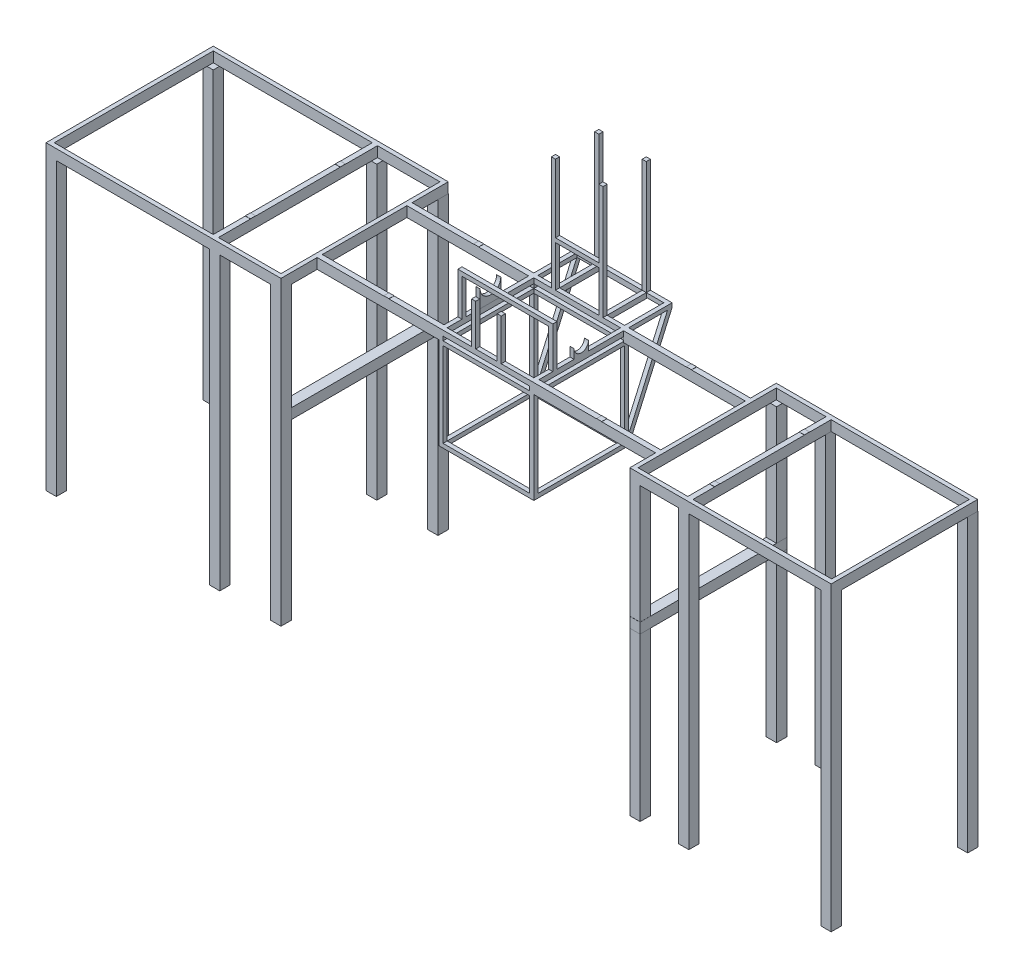
from build123d import *

# Parameters (mm, degrees)
CROQUIS1_W               = 460
CROQUIS1_H               = 460
CROQUIS1_W_2             = 420
CROQUIS1_H_2             = 420
SALIENTE_EXTRUIR1_DEPTH  = 25
CROQUIS2_W               = 20
CROQUIS2_H               = 20
SALIENTE_EXTRUIR2_DEPTH  = 20
CROQUIS3_W               = 460
CROQUIS3_H               = 460
CROQUIS3_W_2             = 420
CROQUIS3_H_2             = 420
SALIENTE_EXTRUIR3_DEPTH  = 20
CROQUIS4_W               = 20
CROQUIS4_H               = 20
SALIENTE_EXTRUIR4_DEPTH  = 410
CROQUIS5_W               = 460
CROQUIS5_H               = 460
CROQUIS5_W_2             = 420
CROQUIS5_H_2             = 420
SALIENTE_EXTRUIR5_DEPTH  = 20
CROQUIS7_W               = 25
CROQUIS7_H               = 50
SALIENTE_EXTRUIR7_DEPTH  = 590
CROQUIS8_W               = 25
CROQUIS8_H               = 50
SALIENTE_EXTRUIR8_DEPTH  = 590
CROQUIS9_W               = 25
CROQUIS9_H               = 25
SALIENTE_EXTRUIR9_DEPTH  = 1
CROQUIS10_W              = 303
CROQUIS10_H              = 770.6
CROQUIS10_W_2            = 241
CROQUIS10_H_2            = 669.6
SALIENTE_EXTRUIR10_DEPTH = 50
CROQUIS11_W              = 50
CROQUIS11_H              = 50
SALIENTE_EXTRUIR11_DEPTH = 1410
CROQUIS13_W              = 20
CROQUIS13_H              = 25
SALIENTE_EXTRUIR12_DEPTH = 210
CROQUIS14_W              = 20
CROQUIS14_H              = 25
SALIENTE_EXTRUIR13_DEPTH = 210
CROQUIS15_W              = 20
CROQUIS15_H              = 20
SALIENTE_EXTRUIR14_DEPTH = 200
CROQUIS16_W              = 20
CROQUIS16_H              = 20
SALIENTE_EXTRUIR15_DEPTH = 550
CROQUIS17_W              = 460
CROQUIS17_H              = 230
CROQUIS17_W_2            = 420
CROQUIS17_H_2            = 190
SALIENTE_EXTRUIR16_DEPTH = 20
SALIENTE_EXTRUIR17_DEPTH = 20
SALIENTE_EXTRUIR18_DEPTH = 20
CROQUIS23_W              = 20
CROQUIS23_H              = 20
SALIENTE_EXTRUIR22_DEPTH = 200
CROQUIS24_W              = 20
CROQUIS24_H              = 20
SALIENTE_EXTRUIR23_DEPTH = 420
SALIENTE_EXTRUIR24_REACH = 2598.882
CROQUIS25_W              = 50
CROQUIS25_H              = 50
SALIENTE_EXTRUIR25_DEPTH = 20
SALIENTE_EXTRUIR26_DEPTH = 20
SALIENTE_EXTRUIR27_REACH = 2475.945
CROQUIS29_W              = 20
CROQUIS29_H              = 20


with BuildPart() as part:
    # Croquis1 → Saliente-Extruir1 (new body)
    with BuildSketch(Plane(origin=(0, 0, 0), x_dir=(1, 0, 0), z_dir=(0, 1, 0))):
        with Locations((230, 230)):
            Rectangle(CROQUIS1_W, CROQUIS1_H)
        with Locations((230, 230)):
            Rectangle(CROQUIS1_W_2, CROQUIS1_H_2, mode=Mode.SUBTRACT)
    extrude(amount=SALIENTE_EXTRUIR1_DEPTH)

    # Croquis2 → Saliente-Extruir2 (add)
    with BuildSketch(Plane.XZ):
        with Locations((10, -10)):
            Rectangle(CROQUIS2_W, CROQUIS2_H)
        with Locations((10, -450)):
            Rectangle(CROQUIS2_W, CROQUIS2_H)
        with Locations((450, -450)):
            Rectangle(CROQUIS2_W, CROQUIS2_H)
        with Locations((450, -10)):
            Rectangle(CROQUIS2_W, CROQUIS2_H)
    extrude(amount=SALIENTE_EXTRUIR2_DEPTH)

    # Croquis3 → Saliente-Extruir3 (add)
    with BuildSketch(Plane.XZ.offset(20)):
        with Locations((230, -230)):
            Rectangle(CROQUIS3_W, CROQUIS3_H)
        with Locations((230, -230)):
            Rectangle(CROQUIS3_W_2, CROQUIS3_H_2, mode=Mode.SUBTRACT)
    extrude(amount=SALIENTE_EXTRUIR3_DEPTH)

    # Croquis4 → Saliente-Extruir4 (add)
    with BuildSketch(Plane.XZ.offset(40)):
        with Locations((10, -10)):
            Rectangle(CROQUIS4_W, CROQUIS4_H)
        with Locations((10, -450)):
            Rectangle(CROQUIS4_W, CROQUIS4_H)
        with Locations((450, -450)):
            Rectangle(CROQUIS4_W, CROQUIS4_H)
        with Locations((450, -10)):
            Rectangle(CROQUIS4_W, CROQUIS4_H)
    extrude(amount=SALIENTE_EXTRUIR4_DEPTH)

    # Croquis5 → Saliente-Extruir5 (add)
    with BuildSketch(Plane.XZ.offset(450)):
        with Locations((230, -230)):
            Rectangle(CROQUIS5_W, CROQUIS5_H)
        with Locations((230, -230)):
            Rectangle(CROQUIS5_W_2, CROQUIS5_H_2, mode=Mode.SUBTRACT)
    extrude(amount=SALIENTE_EXTRUIR5_DEPTH)

    # Croquis7 → Saliente-Extruir7 (add)
    with BuildSketch(Plane.ZY):
        with Locations((-12.5, 0)):
            Rectangle(CROQUIS7_W, CROQUIS7_H)
        with Locations((-447.5, 0)):
            Rectangle(CROQUIS7_W, CROQUIS7_H)
    extrude(amount=SALIENTE_EXTRUIR7_DEPTH)

    # Croquis8 → Saliente-Extruir8 (add)
    with BuildSketch(Plane(origin=(460, 0, 0), x_dir=(0, 0, -1), z_dir=(1, 0, 0))):
        with Locations((12.5, 0)):
            Rectangle(CROQUIS8_W, CROQUIS8_H)
        with Locations((447.5, 0)):
            Rectangle(CROQUIS8_W, CROQUIS8_H)
    extrude(amount=SALIENTE_EXTRUIR8_DEPTH)

    # Croquis9 → Saliente-Extruir9 (add)
    with BuildSketch(Plane(origin=(0, 25, 0), x_dir=(1, 0, 0), z_dir=(0, 1, 0))):
        with Locations((-254.5, 447.5)):
            Rectangle(CROQUIS9_W, CROQUIS9_H)
        with Locations((-254.5, 12.5)):
            Rectangle(CROQUIS9_W, CROQUIS9_H)
        with Locations((776.5, 447.5)):
            Rectangle(CROQUIS9_W, CROQUIS9_H)
        with Locations((776.5, 12.5)):
            Rectangle(CROQUIS9_W, CROQUIS9_H)
        with Locations((-925.5, 12.5)):
            Rectangle(CROQUIS9_W, CROQUIS9_H)
        with Locations((-925.5, 447.5)):
            Rectangle(CROQUIS9_W, CROQUIS9_H)
        with Locations((1323.5, 12.5)):
            Rectangle(CROQUIS9_W, CROQUIS9_H)
        with Locations((1323.5, 447.5)):
            Rectangle(CROQUIS9_W, CROQUIS9_H)
    extrude(amount=SALIENTE_EXTRUIR9_DEPTH)


with BuildPart() as saliente_extruir9_piece_1:
    # of the separate pieces the step leaves, piece 1, a body of its own (saliente_extruir9_pieces)
    add(part.part.solids().sort_by_distance((0, -25, 0))[0])

    # Croquis10 → Saliente-Extruir10 (add)
    # profile 1 of 2: a face of its own
    with BuildSketch(Plane(origin=(0, 25, 0), x_dir=(1, 0, 0), z_dir=(0, 1, 0))):
        Polygon((-590, 635.3), (-590, -175.3), (-1261, -175.3), (-1728.6, -175.3), (-1728.6, 635.3), (-1261, 635.3), align=None)
        with Locations((-761.5, 230)):
            Rectangle(CROQUIS10_W, CROQUIS10_H, mode=Mode.SUBTRACT)
        Polygon((-938, 615.3), (-938, -155.3), (-1241, -155.3), (-1708.6, -155.3), (-1708.6, 615.3), (-1241, 615.3), align=None, mode=Mode.SUBTRACT)
    # profile 2 of 2: a face of its own
    with BuildSketch(Plane(origin=(0, 25, 0), x_dir=(1, 0, 0), z_dir=(0, 1, 0))):
        Polygon((1597, 584.8), (1050, 584.8), (1050, -124.8), (1597, -124.8), (2025.6, -124.8), (2025.6, 584.8), align=None)
        with Locations((1190.5, 230)):
            Rectangle(CROQUIS10_W_2, CROQUIS10_H_2, mode=Mode.SUBTRACT)
        Polygon((1577, -104.8), (1336, -104.8), (1336, 564.8), (1577, 564.8), (2005.6, 564.8), (2005.6, 558.854844607), (2005.6, -102.558683729), align=None, mode=Mode.SUBTRACT)
    extrude(amount=-SALIENTE_EXTRUIR10_DEPTH)

    # Croquis11 → Saliente-Extruir11 (add)
    with BuildSketch(Plane.XZ.offset(25)):
        with Locations((-615, 150.3)):
            Rectangle(CROQUIS11_W, CROQUIS11_H)
        with Locations((1075, 99.8)):
            Rectangle(CROQUIS11_W, CROQUIS11_H)
        with Locations((-1703.6, 150.3)):
            Rectangle(CROQUIS11_W, CROQUIS11_H)
        with Locations((-911.572969947, 150.3)):
            Rectangle(CROQUIS11_W, CROQUIS11_H)
        with Locations((2000.6, 99.8)):
            Rectangle(CROQUIS11_W, CROQUIS11_H)
        with Locations((1310.959511312, 99.8)):
            Rectangle(CROQUIS11_W, CROQUIS11_H)
        Polygon((1285.746012668, -586.609314451), (1285.776023327, -536.609323457), (1335.776014321, -536.639334116), (1335.746003661, -586.63932511), align=None)
        Polygon((1975.386377133, -587.023245764), (1975.416387792, -537.02325477), (2025.416378785, -537.053265429), (2025.386368126, -587.053256423), align=None)
        Polygon((-886.816388023, -635.805322718), (-886.786377364, -585.805331725), (-936.786368357, -585.775321065), (-936.816379016, -635.775312059), align=None)
        Polygon((-1678.84327541, -635.329937653), (-1678.81326475, -585.32994666), (-1728.813255744, -585.299936001), (-1728.843266403, -635.299926994), align=None)
        Polygon((1099.786534853, -586.497699101), (1099.816545512, -536.497708107), (1049.816554518, -536.467697448), (1049.786543859, -586.467688441), align=None)
        Polygon((-640.24346249, -635.953319065), (-640.213451831, -585.953328072), (-590.213460838, -585.983338731), (-590.243471497, -635.983329725), align=None)
    extrude(amount=SALIENTE_EXTRUIR11_DEPTH)

    # Croquis13 → Saliente-Extruir12 (add)
    with BuildSketch(Plane(origin=(0, 0, -460), x_dir=(-1, 0, 0), z_dir=(0, 0, -1))):
        with Locations((-345, 12.5)):
            Rectangle(CROQUIS13_W, CROQUIS13_H)
        with Locations((-115, 12.5)):
            Rectangle(CROQUIS13_W, CROQUIS13_H)
    extrude(amount=SALIENTE_EXTRUIR12_DEPTH)

    # Croquis14 → Saliente-Extruir13 (add)
    with BuildSketch(Plane(origin=(125, 0, 0), x_dir=(0, 0, -1), z_dir=(1, 0, 0))):
        with Locations((660, 12.5)):
            Rectangle(CROQUIS14_W, CROQUIS14_H)
    extrude(amount=SALIENTE_EXTRUIR13_DEPTH)

    # Croquis15 → Saliente-Extruir14 (add)
    with BuildSketch(Plane(origin=(0, 25, 0), x_dir=(1, 0, 0), z_dir=(0, 1, 0))):
        with Locations((292, 10)):
            Rectangle(CROQUIS15_W, CROQUIS15_H)
        with Locations((168, 10)):
            Rectangle(CROQUIS15_W, CROQUIS15_H)
    extrude(amount=SALIENTE_EXTRUIR14_DEPTH)

    # Croquis16 → Saliente-Extruir15 (add)
    with BuildSketch(Plane(origin=(0, 25, 0), x_dir=(1, 0, 0), z_dir=(0, 1, 0))):
        with Locations((345, 660)):
            Rectangle(CROQUIS16_W, CROQUIS16_H)
        with Locations((115, 660)):
            Rectangle(CROQUIS16_W, CROQUIS16_H)
        with Locations((345, 450)):
            Rectangle(CROQUIS16_W, CROQUIS16_H)
        with Locations((115, 450)):
            Rectangle(CROQUIS16_W, CROQUIS16_H)
    extrude(amount=SALIENTE_EXTRUIR15_DEPTH)

    # Croquis17 → Saliente-Extruir16 (add)
    with BuildSketch(Plane(origin=(0, 25, 0), x_dir=(1, 0, 0), z_dir=(0, 1, 0))):
        with Locations((230, 555)):
            Rectangle(CROQUIS17_W, CROQUIS17_H)
        with Locations((230, 555)):
            Rectangle(CROQUIS17_W_2, CROQUIS17_H_2, mode=Mode.SUBTRACT)
    extrude(amount=-SALIENTE_EXTRUIR16_DEPTH)

    # Croquis18 → Saliente-Extruir17 (add)
    with BuildSketch(Plane.ZY):
        Polygon((-670, 5), (-460, -470), (-441.707923693, -461.912976791), (-651.707923693, 13.087023209), align=None)
    extrude(amount=-SALIENTE_EXTRUIR17_DEPTH)

    # Croquis19 → Saliente-Extruir18 (add)
    with BuildSketch(Plane(origin=(460, 0, 0), x_dir=(0, 0, -1), z_dir=(1, 0, 0))):
        Polygon((670, 5), (460, -470), (441.707923693, -461.912976791), (651.707923693, 13.087023209), align=None)
    extrude(amount=-SALIENTE_EXTRUIR18_DEPTH)

    # Croquis23 → Saliente-Extruir22 (add)
    with BuildSketch(Plane(origin=(0, 25, 0), x_dir=(1, 0, 0), z_dir=(0, 1, 0))):
        with Locations((10, 102)):
            Rectangle(CROQUIS23_W, CROQUIS23_H)
        with Locations((450, 102)):
            Rectangle(CROQUIS23_W, CROQUIS23_H)
    extrude(amount=SALIENTE_EXTRUIR22_DEPTH)

    # Croquis24 → Saliente-Extruir23 (add)
    with BuildSketch(Plane.ZY.offset(-440)):
        with Locations((-102, 215)):
            Rectangle(CROQUIS24_W, CROQUIS24_H)
    extrude(amount=SALIENTE_EXTRUIR23_DEPTH)

    # Saliente-Extruir24: up to this face of the body (flat: up to its plane)
    saliente_extruir24_end = Plane(saliente_extruir9_piece_1.part.faces().sort_by_distance((-615, -730, 125.3))[0])
    # Croquis25 → Saliente-Extruir24 (add, up to the picked face)
    with BuildSketch(Plane(origin=(-0.35192749, 0, -586.337381463), x_dir=(0.9999998198720511, 0, -0.0006002131832016912), z_dir=(0.0006002131832016913, 0, 0.9999998198720512)), mode=Mode.PRIVATE) as saliente_extruir24_sk1:
        with Locations((-615.402782414, -568.433632036)):
            Rectangle(CROQUIS25_W, CROQUIS25_H)
    saliente_extruir24_tool1 = split(extrude(saliente_extruir24_sk1.sketch, amount=SALIENTE_EXTRUIR24_REACH, mode=Mode.PRIVATE), bisect_by=saliente_extruir24_end, keep=Keep.BOTH, mode=Mode.PRIVATE)
    # Croquis25 → Saliente-Extruir24 (add, up to the picked face)
    with BuildSketch(Plane(origin=(-0.35192749, 0, -586.337381463), x_dir=(0.9999998198720511, 0, -0.0006002131832016912), z_dir=(0.0006002131832016913, 0, 0.9999998198720512)), mode=Mode.PRIVATE) as saliente_extruir24_sk2:
        with Locations((1075.201192729, -622.872011403)):
            Rectangle(CROQUIS25_W, CROQUIS25_H)
    saliente_extruir24_tool2 = split(extrude(saliente_extruir24_sk2.sketch, amount=SALIENTE_EXTRUIR24_REACH, mode=Mode.PRIVATE), bisect_by=saliente_extruir24_end, keep=Keep.BOTH, mode=Mode.PRIVATE)
    add(saliente_extruir24_tool1.solids().sort_by(Axis((-615.754599, -568.433632, -585.968009), (0.0006002131832016913, 0, 0.9999998198720512)))[0])
    add(saliente_extruir24_tool2.solids().sort_by(Axis((1074.849072, -622.872011, -586.982731), (0.0006002131832016913, 0, 0.9999998198720512)))[0])

    # Croquis28 → Saliente-Extruir26 (add)
    with BuildSketch(Plane(origin=(460, 0, 0), x_dir=(0, 0, -1), z_dir=(1, 0, 0))):
        with BuildLine():
            Line((195, 25), (195, 70))
            ThreePointArc((195, 70), (230, 35), (265, 70))
            Line((265, 70), (265, 25))
            Line((265, 25), (195, 25))
        make_face()
    extrude(amount=-SALIENTE_EXTRUIR26_DEPTH)

    # Croquis29 → Saliente-Extruir27 (add, up to next)
    with BuildSketch(Plane(origin=(125, 0, 0), x_dir=(0, 0, -1), z_dir=(1, 0, 0)), mode=Mode.PRIVATE) as saliente_extruir27_sk1:
        with Locations((450, 235)):
            Rectangle(CROQUIS29_W, CROQUIS29_H)
    saliente_extruir27_tool1 = extrude(saliente_extruir27_sk1.sketch, amount=SALIENTE_EXTRUIR27_REACH, mode=Mode.PRIVATE) - saliente_extruir9_piece_1.part
    add(saliente_extruir27_tool1.solids().sort_by_distance((125, 235, -450))[0])


with BuildPart() as saliente_extruir9_piece_2:
    # of the separate pieces the step leaves, piece 2, a body of its own (saliente_extruir9_pieces)
    add(part.part.solids().sort_by_distance((1311, 25, -460))[0])


with BuildPart() as saliente_extruir9_piece_3:
    # of the separate pieces the step leaves, piece 3, a body of its own (saliente_extruir9_pieces)
    add(part.part.solids().sort_by_distance((-913, 25, 0))[0])


with BuildPart() as saliente_extruir9_piece_4:
    # of the separate pieces the step leaves, piece 4, a body of its own (saliente_extruir9_pieces)
    add(part.part.solids().sort_by_distance((1311, 25, -25))[0])


with BuildPart() as saliente_extruir9_piece_5:
    # of the separate pieces the step leaves, piece 5, a body of its own (saliente_extruir9_pieces)
    add(part.part.solids().sort_by_distance((-938, 25, -460))[0])


with BuildPart() as body_6:
    # Croquis27 → Saliente-Extruir25 (new body)
    with BuildSketch(Plane.ZY):
        with BuildLine():
            Line((-180, 25), (-180, 108))
            ThreePointArc((-180, 108), (-230, 58), (-280, 108))
            Line((-280, 108), (-280, 25))
            Line((-280, 25), (-180, 25))
        make_face()
    extrude(amount=-SALIENTE_EXTRUIR25_DEPTH)


solid = Compound([saliente_extruir9_piece_1.part, saliente_extruir9_piece_2.part, saliente_extruir9_piece_3.part, saliente_extruir9_piece_4.part, saliente_extruir9_piece_5.part, body_6.part])
